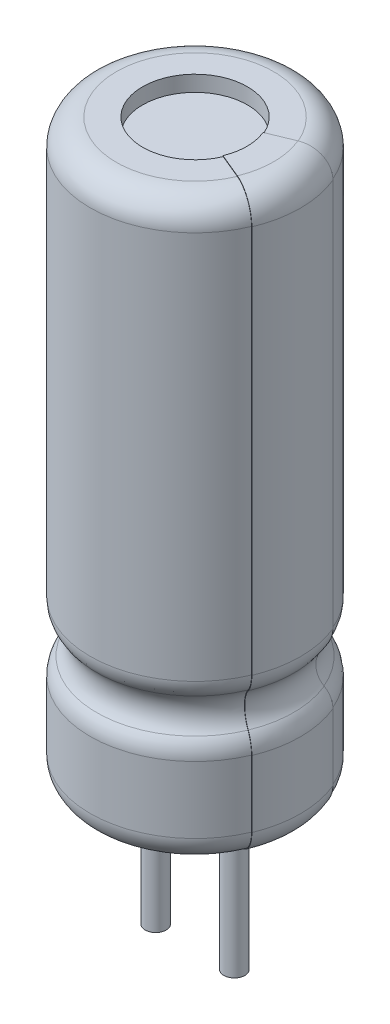
from build123d import *

# Parameters (mm, degrees)
SKETCH2_R      = 0.2
EXTRUDE1_DEPTH = 3
REVOLVE2_ANGLE = 45


with BuildPart() as part:
    # Sketch1 → Revolve1 (revolve)
    with BuildSketch(Plane.XY, mode=Mode.PRIVATE) as revolve1_sk:
        with BuildLine():
            Line((0, 0.3), (0, 10.7))
            Line((0, 10.7), (1, 10.7))
            Line((1, 10.7), (1, 11))
            Line((1, 11), (1.5, 11))
            ThreePointArc((1.5, 11), (1.853553391, 10.853553391), (2, 10.5))
            Line((2, 10.5), (2, 3.09445053))
            ThreePointArc((2, 3.09445053), (1.967707173, 2.917673834), (1.875, 2.763731616))
            ThreePointArc((1.875, 2.763731616), (1.75, 2.433012702), (1.875, 2.102293788))
            ThreePointArc((1.875, 2.102293788), (1.967707173, 1.948351569), (2, 1.771574874))
            Line((2, 1.771574874), (2, 0.5))
            ThreePointArc((2, 0.5), (1.853553391, 0.146446609), (1.5, 0))
            Line((1.5, 0), (1, 0))
            Line((1, 0), (1, 0.3))
            Line((1, 0.3), (0, 0.3))
        make_face()
    revolve(revolve1_sk.sketch.rotate(Axis((0, 0, 0), (0, -1, 0)), 270), axis=Axis((0, 0, 0), (0, -1, 0)))

    # Sketch2 → Extrude1 (add)
    with BuildSketch(Plane.XZ.offset(-0.3)):
        with Locations(Location((-0.75, 0, 0), (0, 0, 270))):
            Circle(SKETCH2_R)
        with Locations(Location((0.75, 0, 0), (0, 0, 90))):
            Circle(SKETCH2_R)
    extrude(amount=EXTRUDE1_DEPTH)

    # Sketch3 → Revolve2 (revolve, symmetric)
    with BuildSketch(Plane.XY) as revolve2_sk:
        with BuildLine():
            Line((0.99, 11.01), (0.99, -0.01))
            Line((0.99, -0.01), (1.5, -0.01))
            ThreePointArc((1.5, -0.01), (1.860624458, 0.139375542), (2.01, 0.5))
            Line((2.01, 0.5), (2.01, 1.771574874))
            ThreePointArc((2.01, 1.771574874), (1.977061317, 1.951887103), (1.8825, 2.108908166))
            ThreePointArc((1.8825, 2.108908166), (1.76, 2.433012702), (1.8825, 2.757117237))
            ThreePointArc((1.8825, 2.757117237), (1.977061317, 2.9141383), (2.01, 3.09445053))
            Line((2.01, 3.09445053), (2.01, 10.5))
            ThreePointArc((2.01, 10.5), (1.860624458, 10.860624458), (1.5, 11.01))
            Line((1.5, 11.01), (0.99, 11.01))
        make_face()
    revolve(axis=Axis((-0.01, 10.71, 0), (0, -1, 0)), revolution_arc=REVOLVE2_ANGLE / 2)
    revolve(revolve2_sk.sketch, axis=Axis((-0.01, 10.71, 0), (0, 1, 0)), revolution_arc=REVOLVE2_ANGLE / 2)


solid = part.part
